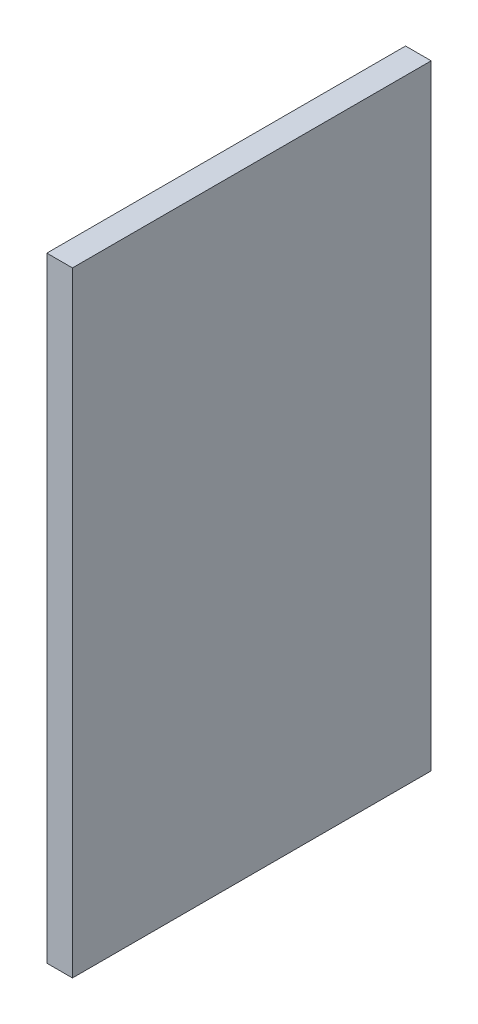
from build123d import *

# Parameters (mm, degrees)
CROQUIS2_W              = 240
CROQUIS2_H              = 140
SALIENTE_EXTRUIR1_DEPTH = 10


with BuildPart() as part:
    # Croquis2 → Saliente-Extruir1 (new body)
    with BuildSketch(Plane.YZ):
        with Locations((120, 70)):
            Rectangle(CROQUIS2_W, CROQUIS2_H)
    extrude(amount=SALIENTE_EXTRUIR1_DEPTH)


solid = part.part
